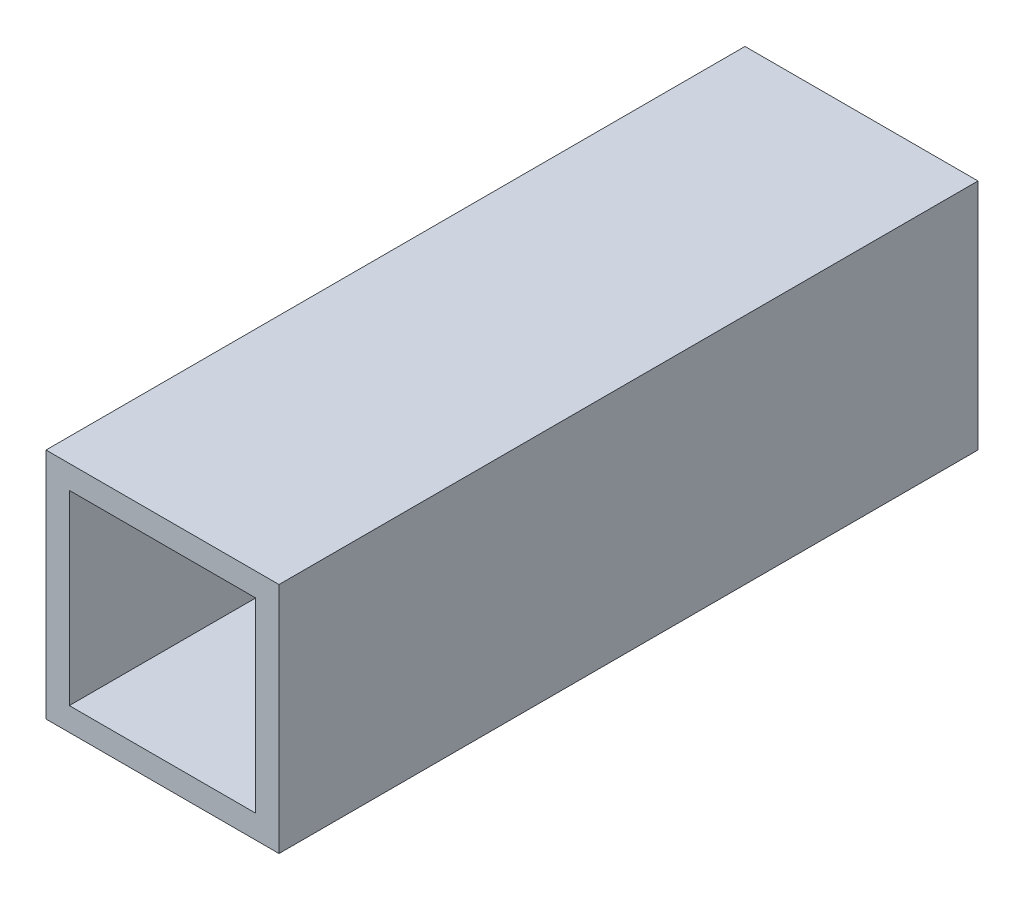
from build123d import *

# Parameters (mm, degrees)
SKETCH2_W           = 50
SKETCH2_H           = 50
SKETCH2_W_2         = 40
SKETCH2_H_2         = 40
BOSS_EXTRUDE1_DEPTH = 150


with BuildPart() as part:
    # Sketch2 → Boss-Extrude1 (new body)
    with BuildSketch(Plane(origin=(0, 0, 0), x_dir=(1, 0, 0), z_dir=(0, 0, -1))):
        Rectangle(SKETCH2_W, SKETCH2_H)
        Rectangle(SKETCH2_W_2, SKETCH2_H_2, mode=Mode.SUBTRACT)
    extrude(amount=-BOSS_EXTRUDE1_DEPTH)


solid = part.part
